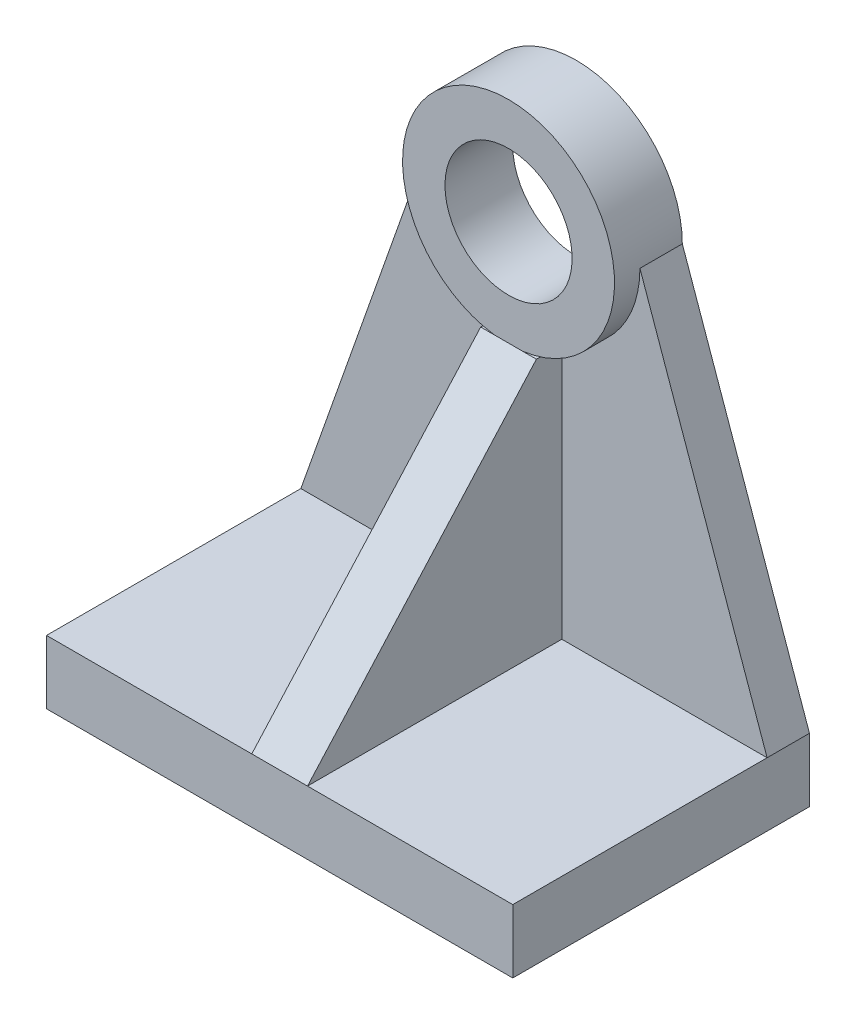
from build123d import *

# Parameters (mm, degrees)
SKETCH1_W           = 139.7
SKETCH1_H           = 88.9
BOSS_EXTRUDE1_DEPTH = 19.05
SKETCH2_R           = 31.75
SKETCH2_R_2         = 19.05
BOSS_EXTRUDE2_DEPTH = 20.32
BOSS_EXTRUDE3_DEPTH = 12.7
SKETCH5_W           = 16.69963643
SKETCH5_H           = 76.2
BOSS_EXTRUDE4_DEPTH = 76.4794
CUT_EXTRUDE1_DEPTH  = 17.018


with BuildPart() as part:
    # Sketch1 → Boss-Extrude1 (new body)
    with BuildSketch(Plane(origin=(0, 0, 0), x_dir=(1, 0, 0), z_dir=(0, 1, 0))):
        Rectangle(SKETCH1_W, SKETCH1_H)
    extrude(amount=BOSS_EXTRUDE1_DEPTH)



with BuildPart() as body_2:
    # Sketch2 → Boss-Extrude2 (new body)
    with BuildSketch(Plane(origin=(0, 0, -44.45), x_dir=(-1, 0, 0), z_dir=(0, 0, -1))):
        with Locations((0, 127)):
            Circle(SKETCH2_R)
        with Locations((0, 127)):
            Circle(SKETCH2_R_2, mode=Mode.SUBTRACT)
    extrude(amount=-BOSS_EXTRUDE2_DEPTH)


with BuildPart() as part_1:
    add(part.part)

    add(body_2.part)  # Boss-Extrude3 merges body 2
    # Sketch3 → Boss-Extrude3 (add)
    with BuildSketch(Plane(origin=(0, 0, -44.45), x_dir=(-1, 0, 0), z_dir=(0, 0, -1))):
        with BuildLine():
            ThreePointArc((-31.75, 127), (0, 95.25), (31.75, 127))
            Line((31.75, 127), (69.85, 19.05))
            Line((69.85, 19.05), (-69.85, 19.05))
            Line((-69.85, 19.05), (-31.75, 127))
        make_face()
    extrude(amount=-BOSS_EXTRUDE3_DEPTH)

    # Sketch5 → Boss-Extrude4 (add)
    with BuildSketch(Plane(origin=(0, 19.05, 0), x_dir=(1, 0, 0), z_dir=(0, 1, 0))):
        with Locations((0, -6.35)):
            Rectangle(SKETCH5_W, SKETCH5_H)
    extrude(amount=BOSS_EXTRUDE4_DEPTH)

    # Sketch6 → Cut-Extrude1 (cut)
    with BuildSketch(Plane.ZY.offset(8.349818215)):
        Polygon((-24.13, 95.5294), (44.45, 19.05), (44.45, 95.5294), align=None)
    extrude(amount=-CUT_EXTRUDE1_DEPTH, mode=Mode.SUBTRACT)


solid = part_1.part
